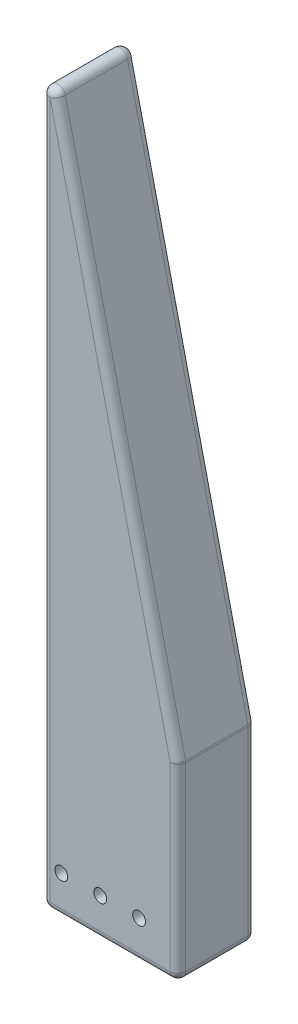
from build123d import *

# Parameters (mm, degrees)
BOSS_EXTRUDE2_DEPTH   = 25.4
F_8_CLEARANCE_HOLE1_D = 4.191
FILLET1_R             = 2.54


with BuildPart() as part:
    # Sketch2 → Boss-Extrude2 (new body)
    with BuildSketch(Plane.XY):
        Polygon((92.922616299, 8.043671593), (48.599616303, 8.043671593), (48.599616303, 260.300358649), (92.922616299, 69.957537027), align=None)
    extrude(amount=BOSS_EXTRUDE2_DEPTH)

    # #8 Clearance Hole1 (through all)
    with Locations(Plane(origin=(0, 0, 0), x_dir=(-1, 0, 0), z_dir=(0, 0, -1))):
        with Locations((-80.22261633, 20.616671539), (-67.52261633, 20.616671539), (-54.82261633, 20.616671539)):
            Hole(F_8_CLEARANCE_HOLE1_D / 2)

    # Fillet1
    fillet1_edges = [part.edges().sort_by_distance(p)[0] for p in [
        (92.922616299, 39.00060431, 25.4),
        (70.761116301, 165.128947838, 25.4),
        (48.599616303, 134.172015121, 25.4),
        (70.761116301, 165.128947838, 0),
        (92.922616299, 39.00060431, 0),
        (70.761116301, 8.043671593, 0),
        (48.599616303, 134.172015121, 0),
        (70.761116301, 8.043671593, 25.4),
        (48.599616303, 260.300358649, 12.7),
        (92.922616299, 69.957537027, 12.7),
        (92.922616299, 8.043671593, 12.7),
        (48.599616303, 8.043671593, 12.7),
    ]]
    fillet(fillet1_edges, radius=FILLET1_R)


solid = part.part
